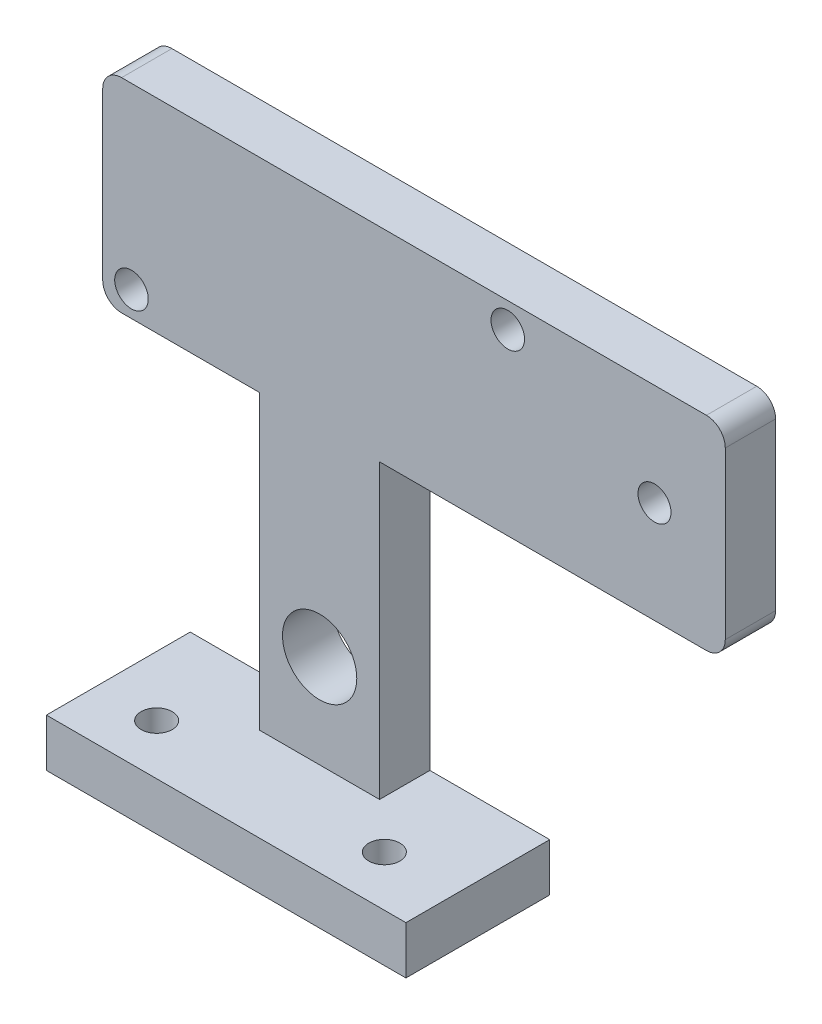
from build123d import *

# Parameters (mm, degrees)
SKETCH1_W           = 38.1
SKETCH1_H           = 15.24
BOSS_EXTRUDE1_DEPTH = 5.08
SKETCH2_R           = 1.651
CUT_EXTRUDE1_DEPTH  = 119.490202326
SKETCH3_W           = 12.7
SKETCH3_H           = 5.334
BOSS_EXTRUDE2_DEPTH = 30.988
SKETCH6_W           = 45.974
SKETCH6_H           = 5.334
BOSS_EXTRUDE3_DEPTH = 21.59
SKETCH7_R           = 1.778
CUT_EXTRUDE4_DEPTH  = 118.755224526
SKETCH8_R           = 3.937
CUT_EXTRUDE5_DEPTH  = 118.755224526
SKETCH9_W           = 5.334
SKETCH9_H           = 21.59
BOSS_EXTRUDE4_DEPTH = 20
SKETCH10_R          = 1.75
CUT_EXTRUDE6_DEPTH  = 118.755224526
FILLET1_R           = 2
FILLET2_R           = 2


with BuildPart() as part:
    # Sketch1 → Boss-Extrude1 (new body)
    with BuildSketch(Plane(origin=(0, 0, 0), x_dir=(1, 0, 0), z_dir=(0, 1, 0))):
        with Locations((-81.911608108, 54.193229454)):
            Rectangle(SKETCH1_W, SKETCH1_H)
    extrude(amount=-BOSS_EXTRUDE1_DEPTH)

    # Sketch2 → Cut-Extrude1 (cut, through all)
    with BuildSketch(Plane(origin=(0, 0, 0), x_dir=(1, 0, 0), z_dir=(0, 1, 0))):
        with Locations(Location((-94.611608108, 51.907229454, 0), (0, 0, 270))):
            Circle(SKETCH2_R)
        with Locations(Location((-70.481608108, 51.907229454, 0), (0, 0, 270))):
            Circle(SKETCH2_R)
    extrude(amount=-CUT_EXTRUDE1_DEPTH, mode=Mode.SUBTRACT)

    # Sketch3 → Boss-Extrude2 (add)
    with BuildSketch(Plane(origin=(0, 0, 0), x_dir=(1, 0, 0), z_dir=(0, 1, 0))):
        with Locations((-81.911608108, 59.146229454)):
            Rectangle(SKETCH3_W, SKETCH3_H)
    extrude(amount=BOSS_EXTRUDE2_DEPTH)

    # Sketch6 → Boss-Extrude3 (add)
    with BuildSketch(Plane(origin=(0, 30.988, 0), x_dir=(1, 0, 0), z_dir=(0, 1, 0))):
        with Locations((-81.911608108, 59.146229454)):
            Rectangle(SKETCH6_W, SKETCH6_H)
    extrude(amount=BOSS_EXTRUDE3_DEPTH)

    # Sketch7 → Cut-Extrude4 (cut, through all)
    with BuildSketch(Plane.XY.offset(-56.479229454)):
        with Locations((-101.850608108, 33.655)):
            Circle(SKETCH7_R)
        with Locations((-61.972608108, 49.911)):
            Circle(SKETCH7_R)
    extrude(amount=-CUT_EXTRUDE4_DEPTH, mode=Mode.SUBTRACT)

    # Sketch8 → Cut-Extrude5 (cut, through all)
    with BuildSketch(Plane.XY.offset(-56.479229454)):
        with Locations((-81.911608108, 9.906)):
            Circle(SKETCH8_R)
    extrude(amount=-CUT_EXTRUDE5_DEPTH, mode=Mode.SUBTRACT)

    # Sketch9 → Boss-Extrude4 (add)
    with BuildSketch(Plane(origin=(-58.924608108, 0, 0), x_dir=(0, 0, -1), z_dir=(1, 0, 0))):
        with Locations((59.146229454, 41.783)):
            Rectangle(SKETCH9_W, SKETCH9_H)
    extrude(amount=BOSS_EXTRUDE4_DEPTH)

    # Sketch10 → Cut-Extrude6 (cut, through all)
    with BuildSketch(Plane.XY.offset(-56.479229454)):
        with Locations((-46.424608108, 41.783)):
            Circle(SKETCH10_R)
    extrude(amount=-CUT_EXTRUDE6_DEPTH, mode=Mode.SUBTRACT)

    # Fillet1
    fillet1_edges = [part.edges().sort_by_distance(p)[0] for p in [
        (-38.924608108, 30.988, -59.146229454),
        (-38.924608108, 52.578, -59.146229454),
    ]]
    fillet(fillet1_edges, radius=FILLET1_R)

    # Fillet2
    fillet2_edges = [part.edges().sort_by_distance(p)[0] for p in [
        (-104.898608108, 30.988, -59.146229454),
        (-104.898608108, 52.578, -59.146229454),
    ]]
    fillet(fillet2_edges, radius=FILLET2_R)


solid = part.part
